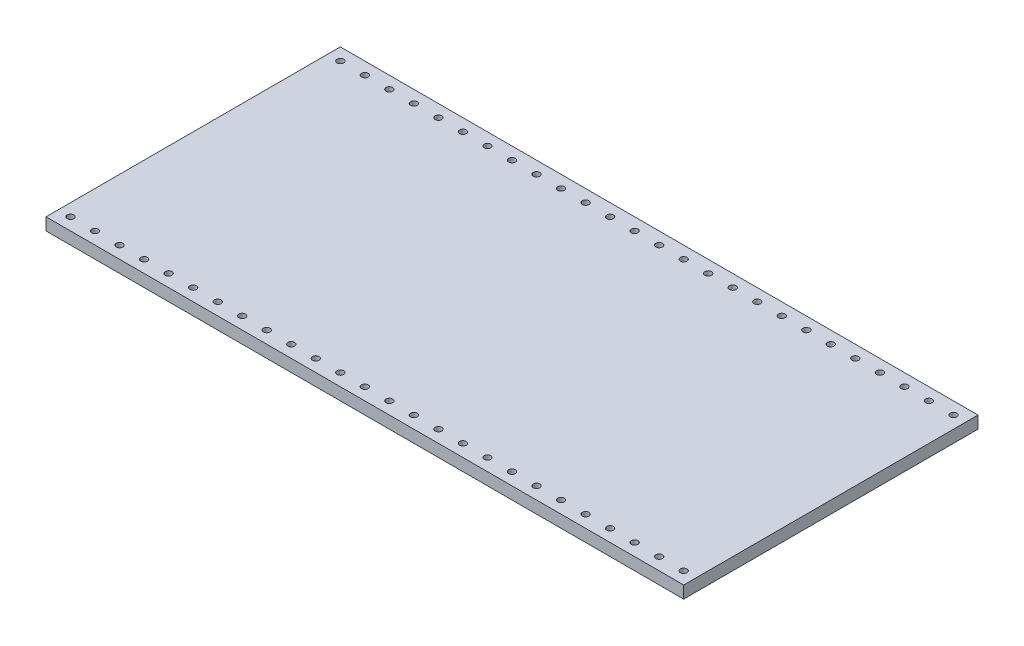
from build123d import *

# Parameters (mm, degrees)
SKETCH1_W           = 660.4
SKETCH1_H           = 304.8
SKETCH1_R           = 3.429
BOSS_EXTRUDE1_DEPTH = 12.7


with BuildPart() as part:
    # Sketch1 → Boss-Extrude1 (new body)
    with BuildSketch(Plane(origin=(0, 0, 0), x_dir=(1, 0, 0), z_dir=(0, 1, 0))):
        Rectangle(SKETCH1_W, SKETCH1_H)
        with Locations(Location((-317.5, 139.7, 0), (0, 0, 270))):
            Circle(SKETCH1_R, mode=Mode.SUBTRACT)
        with Locations(Location((-292.1, 139.7, 0), (0, 0, 270))):
            Circle(SKETCH1_R, mode=Mode.SUBTRACT)
        with Locations(Location((-266.7, 139.7, 0), (0, 0, 270))):
            Circle(SKETCH1_R, mode=Mode.SUBTRACT)
        with Locations(Location((-241.3, 139.7, 0), (0, 0, 270))):
            Circle(SKETCH1_R, mode=Mode.SUBTRACT)
        with Locations(Location((-215.9, 139.7, 0), (0, 0, 270))):
            Circle(SKETCH1_R, mode=Mode.SUBTRACT)
        with Locations(Location((-190.5, 139.7, 0), (0, 0, 270))):
            Circle(SKETCH1_R, mode=Mode.SUBTRACT)
        with Locations(Location((-165.1, 139.7, 0), (0, 0, 270))):
            Circle(SKETCH1_R, mode=Mode.SUBTRACT)
        with Locations(Location((-139.7, 139.7, 0), (0, 0, 270))):
            Circle(SKETCH1_R, mode=Mode.SUBTRACT)
        with Locations(Location((-114.3, 139.7, 0), (0, 0, 270))):
            Circle(SKETCH1_R, mode=Mode.SUBTRACT)
        with Locations(Location((-88.9, 139.7, 0), (0, 0, 270))):
            Circle(SKETCH1_R, mode=Mode.SUBTRACT)
        with Locations(Location((-63.5, 139.7, 0), (0, 0, 270))):
            Circle(SKETCH1_R, mode=Mode.SUBTRACT)
        with Locations(Location((-38.1, 139.7, 0), (0, 0, 270))):
            Circle(SKETCH1_R, mode=Mode.SUBTRACT)
        with Locations(Location((-12.7, 139.7, 0), (0, 0, 270))):
            Circle(SKETCH1_R, mode=Mode.SUBTRACT)
        with Locations(Location((12.7, 139.7, 0), (0, 0, 270))):
            Circle(SKETCH1_R, mode=Mode.SUBTRACT)
        with Locations(Location((38.1, 139.7, 0), (0, 0, 270))):
            Circle(SKETCH1_R, mode=Mode.SUBTRACT)
        with Locations(Location((63.5, 139.7, 0), (0, 0, 270))):
            Circle(SKETCH1_R, mode=Mode.SUBTRACT)
        with Locations(Location((88.9, 139.7, 0), (0, 0, 270))):
            Circle(SKETCH1_R, mode=Mode.SUBTRACT)
        with Locations(Location((114.3, 139.7, 0), (0, 0, 270))):
            Circle(SKETCH1_R, mode=Mode.SUBTRACT)
        with Locations(Location((139.7, 139.7, 0), (0, 0, 270))):
            Circle(SKETCH1_R, mode=Mode.SUBTRACT)
        with Locations(Location((165.1, 139.7, 0), (0, 0, 270))):
            Circle(SKETCH1_R, mode=Mode.SUBTRACT)
        with Locations(Location((190.5, 139.7, 0), (0, 0, 270))):
            Circle(SKETCH1_R, mode=Mode.SUBTRACT)
        with Locations(Location((215.9, 139.7, 0), (0, 0, 270))):
            Circle(SKETCH1_R, mode=Mode.SUBTRACT)
        with Locations(Location((241.3, 139.7, 0), (0, 0, 270))):
            Circle(SKETCH1_R, mode=Mode.SUBTRACT)
        with Locations(Location((266.7, 139.7, 0), (0, 0, 270))):
            Circle(SKETCH1_R, mode=Mode.SUBTRACT)
        with Locations(Location((292.1, 139.7, 0), (0, 0, 270))):
            Circle(SKETCH1_R, mode=Mode.SUBTRACT)
        with Locations(Location((317.5, 139.7, 0), (0, 0, 270))):
            Circle(SKETCH1_R, mode=Mode.SUBTRACT)
        with Locations(Location((-292.1, -139.7, 0), (0, 0, 270))):
            Circle(SKETCH1_R, mode=Mode.SUBTRACT)
        with Locations(Location((-266.7, -139.7, 0), (0, 0, 270))):
            Circle(SKETCH1_R, mode=Mode.SUBTRACT)
        with Locations(Location((-241.3, -139.7, 0), (0, 0, 270))):
            Circle(SKETCH1_R, mode=Mode.SUBTRACT)
        with Locations(Location((-215.9, -139.7, 0), (0, 0, 270))):
            Circle(SKETCH1_R, mode=Mode.SUBTRACT)
        with Locations(Location((-190.5, -139.7, 0), (0, 0, 270))):
            Circle(SKETCH1_R, mode=Mode.SUBTRACT)
        with Locations(Location((-165.1, -139.7, 0), (0, 0, 270))):
            Circle(SKETCH1_R, mode=Mode.SUBTRACT)
        with Locations(Location((-139.7, -139.7, 0), (0, 0, 270))):
            Circle(SKETCH1_R, mode=Mode.SUBTRACT)
        with Locations(Location((-114.3, -139.7, 0), (0, 0, 270))):
            Circle(SKETCH1_R, mode=Mode.SUBTRACT)
        with Locations(Location((-88.9, -139.7, 0), (0, 0, 270))):
            Circle(SKETCH1_R, mode=Mode.SUBTRACT)
        with Locations(Location((-63.5, -139.7, 0), (0, 0, 270))):
            Circle(SKETCH1_R, mode=Mode.SUBTRACT)
        with Locations(Location((-38.1, -139.7, 0), (0, 0, 270))):
            Circle(SKETCH1_R, mode=Mode.SUBTRACT)
        with Locations(Location((-12.7, -139.7, 0), (0, 0, 270))):
            Circle(SKETCH1_R, mode=Mode.SUBTRACT)
        with Locations(Location((12.7, -139.7, 0), (0, 0, 270))):
            Circle(SKETCH1_R, mode=Mode.SUBTRACT)
        with Locations(Location((38.1, -139.7, 0), (0, 0, 270))):
            Circle(SKETCH1_R, mode=Mode.SUBTRACT)
        with Locations(Location((63.5, -139.7, 0), (0, 0, 270))):
            Circle(SKETCH1_R, mode=Mode.SUBTRACT)
        with Locations(Location((88.9, -139.7, 0), (0, 0, 270))):
            Circle(SKETCH1_R, mode=Mode.SUBTRACT)
        with Locations(Location((114.3, -139.7, 0), (0, 0, 270))):
            Circle(SKETCH1_R, mode=Mode.SUBTRACT)
        with Locations(Location((139.7, -139.7, 0), (0, 0, 270))):
            Circle(SKETCH1_R, mode=Mode.SUBTRACT)
        with Locations(Location((165.1, -139.7, 0), (0, 0, 270))):
            Circle(SKETCH1_R, mode=Mode.SUBTRACT)
        with Locations(Location((190.5, -139.7, 0), (0, 0, 270))):
            Circle(SKETCH1_R, mode=Mode.SUBTRACT)
        with Locations(Location((215.9, -139.7, 0), (0, 0, 270))):
            Circle(SKETCH1_R, mode=Mode.SUBTRACT)
        with Locations(Location((241.3, -139.7, 0), (0, 0, 270))):
            Circle(SKETCH1_R, mode=Mode.SUBTRACT)
        with Locations(Location((266.7, -139.7, 0), (0, 0, 270))):
            Circle(SKETCH1_R, mode=Mode.SUBTRACT)
        with Locations(Location((292.1, -139.7, 0), (0, 0, 270))):
            Circle(SKETCH1_R, mode=Mode.SUBTRACT)
        with Locations(Location((317.5, -139.7, 0), (0, 0, 270))):
            Circle(SKETCH1_R, mode=Mode.SUBTRACT)
        with Locations(Location((-317.5, -139.7, 0), (0, 0, 270))):
            Circle(SKETCH1_R, mode=Mode.SUBTRACT)
    extrude(amount=-BOSS_EXTRUDE1_DEPTH)


solid = part.part
